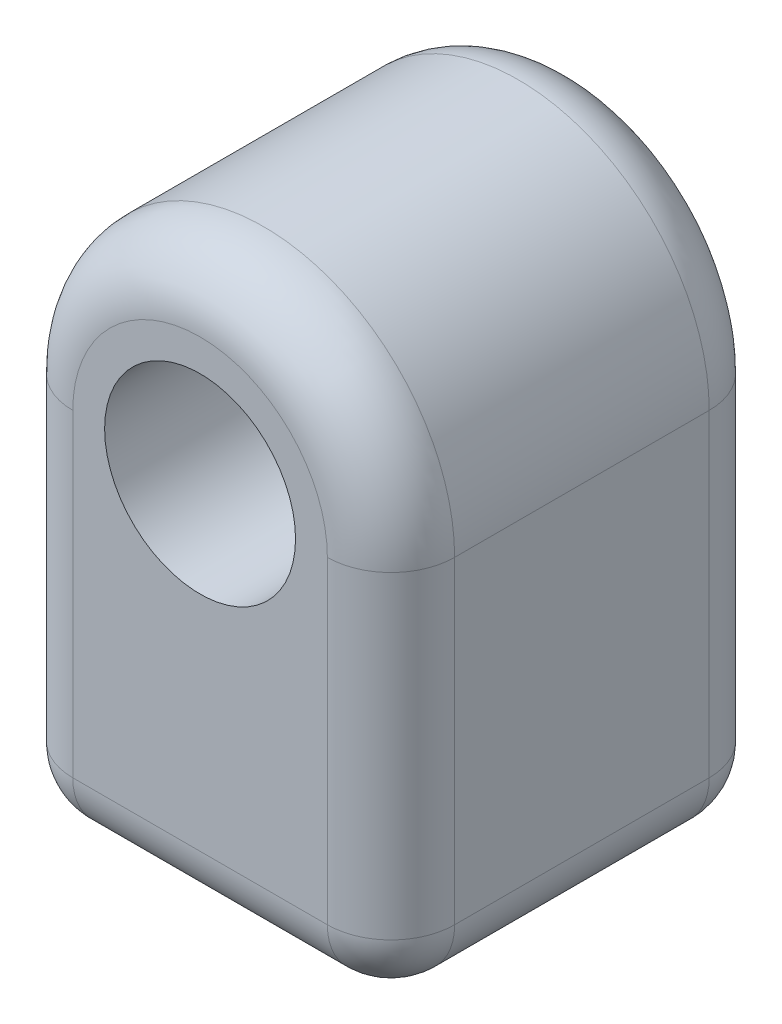
from build123d import *

# Parameters (mm, degrees)
CROQUIS1_R              = 1.5
SALIENTE_EXTRUIR1_DEPTH = 6
CROQUIS2_W              = 2.5
CROQUIS2_H              = 1.5
CORTAR_EXTRUIR1_DEPTH   = 6
REDONDEO3_R             = 1


with BuildPart() as part:
    # Croquis1 → Saliente-Extruir1 (new body)
    with BuildSketch(Plane.XY):
        with BuildLine():
            Line((-3, 0), (-3, -6))
            Line((-3, -6), (3, -6))
            Line((3, -6), (3, 0))
            ThreePointArc((3, 0), (0, 3), (-3, 0))
        make_face()
        Circle(CROQUIS1_R, mode=Mode.SUBTRACT)
    extrude(amount=SALIENTE_EXTRUIR1_DEPTH)

    # Croquis2 → Cortar-Extruir1 (cut, along a direction that is not the sketch's normal)
    with BuildSketch(Plane(origin=(0, 0, 0), x_dir=(-1, 0, 0), z_dir=(0, 0, -1))):
        with Locations((0, -2.75)):
            Rectangle(CROQUIS2_W, CROQUIS2_H)
    extrude(amount=-CORTAR_EXTRUIR1_DEPTH, dir=(0, 0.7071067811865436, -0.7071067811865515), mode=Mode.SUBTRACT)

    # Redondeo3
    redondeo3_edges = [part.edges().sort_by_distance(p)[0] for p in [
        (0, -6, 6),
        (3, -3, 6),
        (0, 3, 6),
        (3, -3, 0),
        (0, -6, 0),
        (-3, -3, 0),
        (0, 3, 0),
        (-3, -3, 6),
        (3, -6, 3),
        (-3, -6, 3),
    ]]
    fillet(redondeo3_edges, radius=REDONDEO3_R)


solid = part.part
